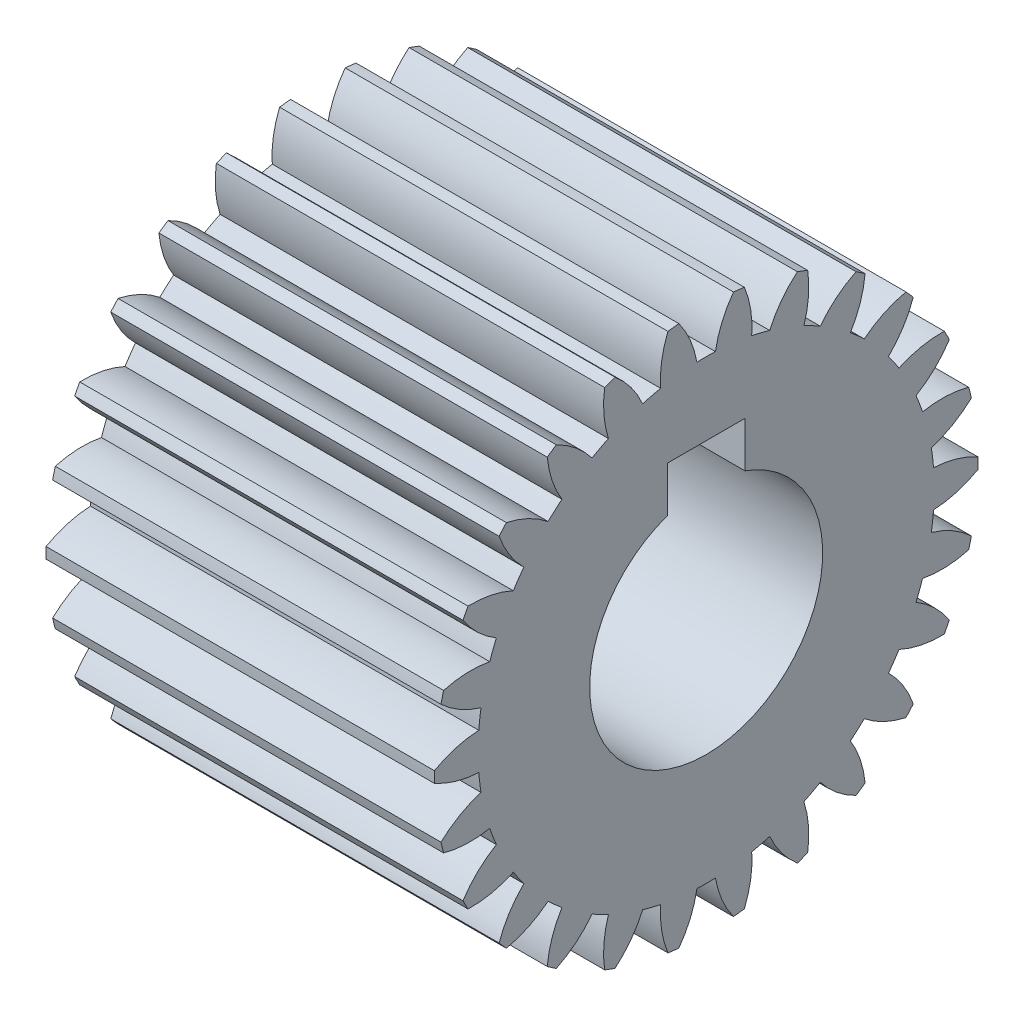
from build123d import *

# Parameters (mm, degrees)
BASPROSKE_W     = 10
BASPROSKE_H     = 7
TOOTHCUT_DEPTH  = 15.071247279
TEETHCUTS_COUNT = 26
TEETHCUTS_ANGLE = 346.153846154
BORSKE_R        = 3
BORE_DEPTH      = 50.0000508
KEYSKE_W        = 2
KEYSKE_H        = 4
KEYWAY_DEPTH    = 50.0000508


with BuildPart() as part:
    # BasProSke → Base-Revolve (revolve)
    with BuildSketch(Plane(origin=(0, 0, 0), x_dir=(1, 0, 0), z_dir=(0, 1, 0)), mode=Mode.PRIVATE) as base_revolve_sk:
        with Locations((5, 3.5)):
            Rectangle(BASPROSKE_W, BASPROSKE_H)
    revolve(base_revolve_sk.sketch.rotate(Axis((-10, 0, 0), (1, 0, 0)), 180), axis=Axis((-10, 0, 0), (1, 0, 0)))

    # TooCutSke → ToothCut (cut, through all)
    with BuildSketch(Plane(origin=(0, 0, 0), x_dir=(0, 0, -1), z_dir=(1, 0, 0))):
        with BuildLine():
            ThreePointArc((0.238396934, 5.869160323), (0, 5.874), (-0.238396934, 5.869160323))
            ThreePointArc((-0.238396934, 5.869160323), (-0.413148985, 6.457408383), (-0.720902762, 6.988314845))
            ThreePointArc((-0.720902762, 6.988314845), (0, 7.0254), (0.720902762, 6.988314845))
            ThreePointArc((0.720902762, 6.988314845), (0.413148985, 6.457408383), (0.238396934, 5.869160323))
        make_face()
    toothcut = extrude(amount=TOOTHCUT_DEPTH, mode=Mode.SUBTRACT)

    # TeethCuts: ToothCut ×26 about axis
    teethcuts_axis = Axis((-10, 0, 0), (1, 0, 0))
    for i in range(1, TEETHCUTS_COUNT):
        add(toothcut.rotate(teethcuts_axis, i * TEETHCUTS_ANGLE / (TEETHCUTS_COUNT - 1)), mode=Mode.SUBTRACT)

    # BorSke → Bore (cut, symmetric)
    with BuildSketch(Plane(origin=(0, 0, 0), x_dir=(0, 0, -1), z_dir=(1, 0, 0))):
        with Locations(Location((0, 0, 0), (0, 0, 180))):
            Circle(BORSKE_R)
    extrude(amount=BORE_DEPTH, both=True, mode=Mode.SUBTRACT)

    # KeySke → Keyway (cut, symmetric)
    with BuildSketch(Plane(origin=(0, 0, 0), x_dir=(0, 0, -1), z_dir=(1, 0, 0))):
        with Locations((0, 2)):
            Rectangle(KEYSKE_W, KEYSKE_H)
    extrude(amount=KEYWAY_DEPTH, both=True, mode=Mode.SUBTRACT)


solid = part.part
